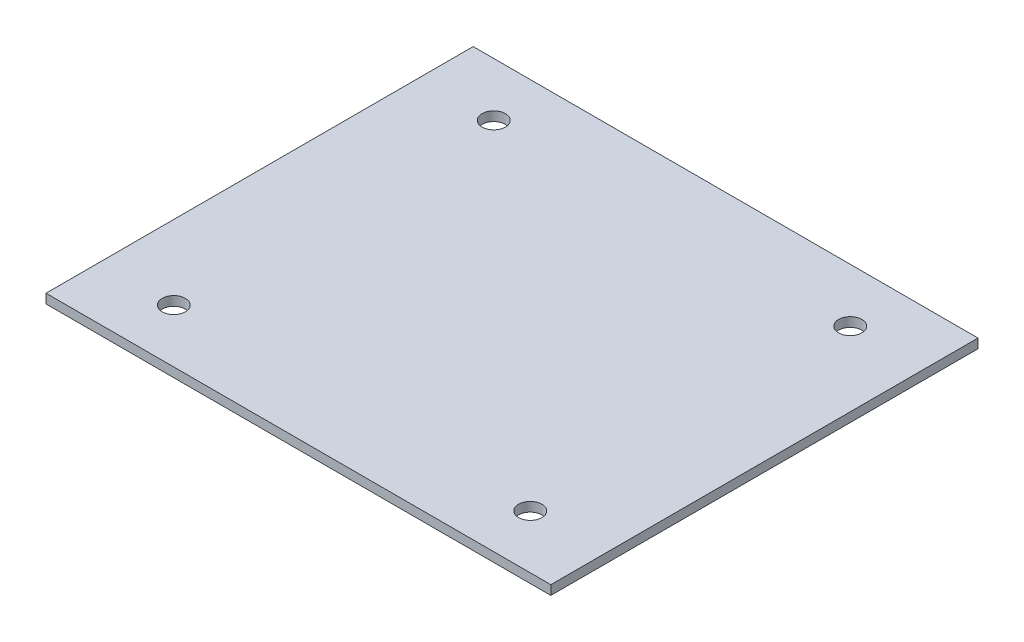
from build123d import *

# Parameters (mm, degrees)
SKETCH_2_W      = 65
SKETCH_2_H      = 55
SKETCH_2_R      = 1.5
EXTRUDE_2_DEPTH = 1.2


with BuildPart() as part:
    # 草图2 → 凸台-拉伸2 (new body)
    with BuildSketch(Plane(origin=(0, 0, 0), x_dir=(1, 0, 0), z_dir=(0, 1, 0))):
        Rectangle(SKETCH_2_W, SKETCH_2_H)
        with Locations(Location((-22.95, 20.6, 0), (0, 0, 270))):
            Circle(SKETCH_2_R, mode=Mode.SUBTRACT)
        with Locations(Location((-22.95, -20.6, 0), (0, 0, 270))):
            Circle(SKETCH_2_R, mode=Mode.SUBTRACT)
        with Locations(Location((22.95, -20.6, 0), (0, 0, 90))):
            Circle(SKETCH_2_R, mode=Mode.SUBTRACT)
        with Locations(Location((22.95, 20.6, 0), (0, 0, 90))):
            Circle(SKETCH_2_R, mode=Mode.SUBTRACT)
    extrude(amount=EXTRUDE_2_DEPTH)


solid = part.part
